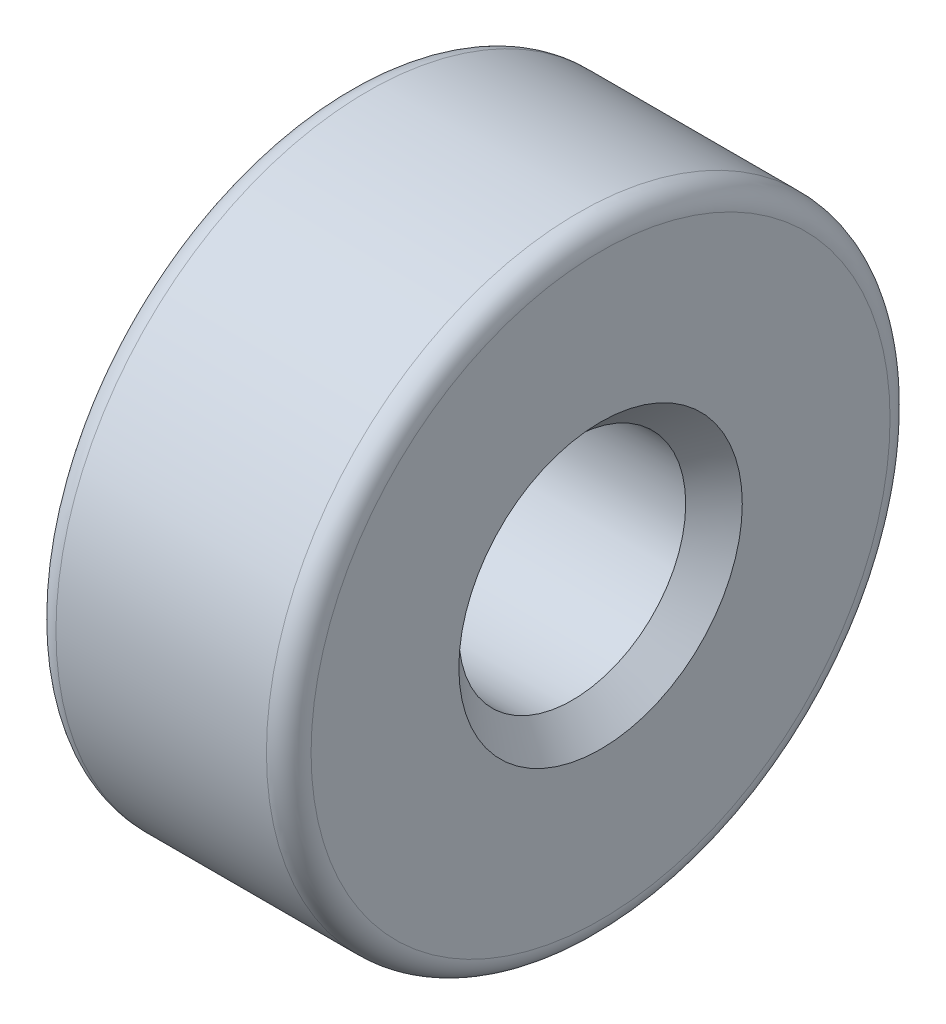
from build123d import *

# Parameters (mm, degrees)
FILLET1_R = 10


with BuildPart() as part:
    # Sketch1 → Revolve1 (revolve)
    with BuildSketch(Plane.XY, mode=Mode.PRIVATE) as revolve1_sk:
        Polygon((12.671353519, 50.828646481), (49.214586006, 50.828646481), (96.294527469, 50.828646481), (101.628646481, 50.828646481), (114.3, 63.5), (114.3, 139.7), (0, 139.7), (0, 63.5), align=None)
    revolve(revolve1_sk.sketch.rotate(Axis((0, 0, 0), (1, 0, 0)), 90), axis=Axis((0, 0, 0), (1, 0, 0)))

    # Fillet1
    fillet1_edges = [part.edges().sort_by_distance(p)[0] for p in [
        (0, 0, -139.7),
        (114.3, 0, -139.7),
    ]]
    fillet(fillet1_edges, radius=FILLET1_R)


solid = part.part
